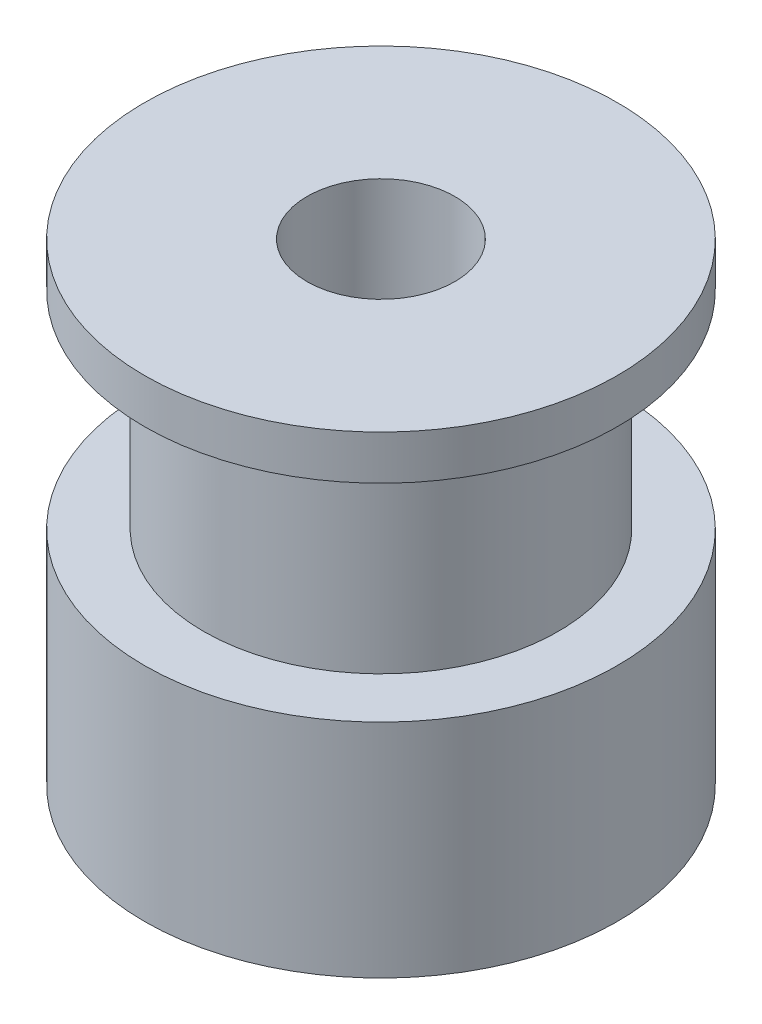
from build123d import *


with BuildPart() as part:
    # Esboço1 → Revolução1 (revolve)
    with BuildSketch(Plane.XY, mode=Mode.PRIVATE) as revolu_o1_sk:
        Polygon((2.5, 16), (8, 16), (8, 14.5), (6, 14.5), (6, 7.5), (8, 7.5), (8, 0), (2.5, 0), align=None)
    revolve(revolu_o1_sk.sketch.rotate(Axis((0, 15.012358039, 0), (0, -1, 0)), 90), axis=Axis((0, 15.012358039, 0), (0, -1, 0)))


solid = part.part
